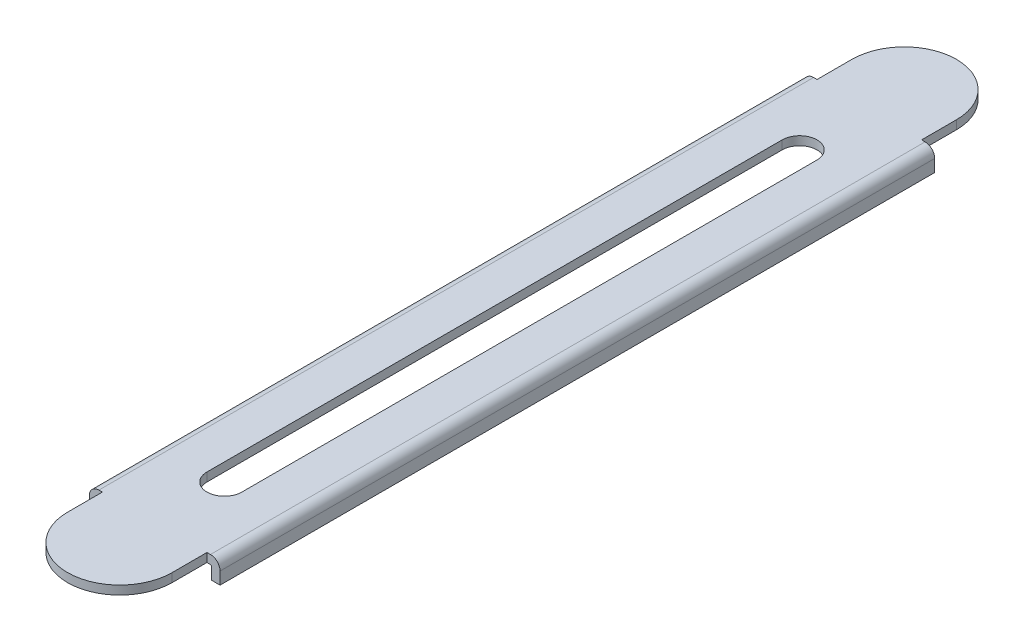
from build123d import *

# Parameters (mm, degrees)
SALIENTE_EXTRUIR1_DEPTH = 1
CROQUIS2_W              = 82
CROQUIS2_H              = 1
SALIENTE_EXTRUIR2_DEPTH = 1.5
CROQUIS3_W              = 1
CROQUIS3_H              = 82
SALIENTE_EXTRUIR3_DEPTH = 1.5
CROQUIS4_W              = 82
CROQUIS4_H              = 1
SALIENTE_EXTRUIR4_DEPTH = 1.5
CROQUIS5_W              = 1
CROQUIS5_H              = 82
SALIENTE_EXTRUIR5_DEPTH = 1.5
CORTAR_EXTRUIR1_DEPTH   = 105.271280802
REDONDEO1_R             = 0.1
REDONDEO2_R             = 1.1


with BuildPart() as part:
    # Croquis1 → Saliente-Extruir1 (new body)
    with BuildSketch(Plane.XZ.offset(-44.742417107)):
        with BuildLine():
            Line((20, -96), (20, -6))
            ThreePointArc((20, -6), (14, 0), (8, -6))
            Line((8, -6), (8, -96))
            ThreePointArc((8, -96), (14, -102), (20, -96))
        make_face()
    extrude(amount=-SALIENTE_EXTRUIR1_DEPTH)

    # Croquis2 → Saliente-Extruir2 (add)
    with BuildSketch(Plane(origin=(20, 0, 0), x_dir=(0, 0, -1), z_dir=(1, 0, 0))):
        with Locations((51, 45.242417107)):
            Rectangle(CROQUIS2_W, CROQUIS2_H)
    extrude(amount=SALIENTE_EXTRUIR2_DEPTH)

    # Croquis3 → Saliente-Extruir3 (add)
    with BuildSketch(Plane.XZ.offset(-44.742417107)):
        with Locations((21, -51)):
            Rectangle(CROQUIS3_W, CROQUIS3_H)
    extrude(amount=SALIENTE_EXTRUIR3_DEPTH)

    # Croquis4 → Saliente-Extruir4 (add)
    with BuildSketch(Plane.ZY.offset(-8)):
        with Locations((-51, 45.242417107)):
            Rectangle(CROQUIS4_W, CROQUIS4_H)
    extrude(amount=SALIENTE_EXTRUIR4_DEPTH)

    # Croquis5 → Saliente-Extruir5 (add)
    with BuildSketch(Plane.XZ.offset(-44.742417107)):
        with Locations((7, -51)):
            Rectangle(CROQUIS5_W, CROQUIS5_H)
    extrude(amount=SALIENTE_EXTRUIR5_DEPTH)

    # Croquis6 → Cortar-Extruir1 (cut, through all)
    with BuildSketch(Plane(origin=(0, 45.742417107, 0), x_dir=(-1, 0, 0), z_dir=(0, 1, 0))):
        with BuildLine():
            Line((-12, -84), (-12, -18))
            ThreePointArc((-12, -18), (-14, -16), (-16, -18))
            Line((-16, -18), (-16, -84))
            ThreePointArc((-16, -84), (-14, -86), (-12, -84))
        make_face()
    extrude(amount=-CORTAR_EXTRUIR1_DEPTH, mode=Mode.SUBTRACT)

    # Redondeo1
    redondeo1_edges = [part.edges().sort_by_distance(p)[0] for p in [
        (20.5, 44.742417107, -51),
        (7.5, 44.742417107, -51),
    ]]
    fillet(redondeo1_edges, radius=REDONDEO1_R)

    # Redondeo2
    redondeo2_edges = [part.edges().sort_by_distance(p)[0] for p in [
        (21.5, 45.742417107, -51),
        (6.5, 45.742417107, -51),
    ]]
    fillet(redondeo2_edges, radius=REDONDEO2_R)


solid = part.part
